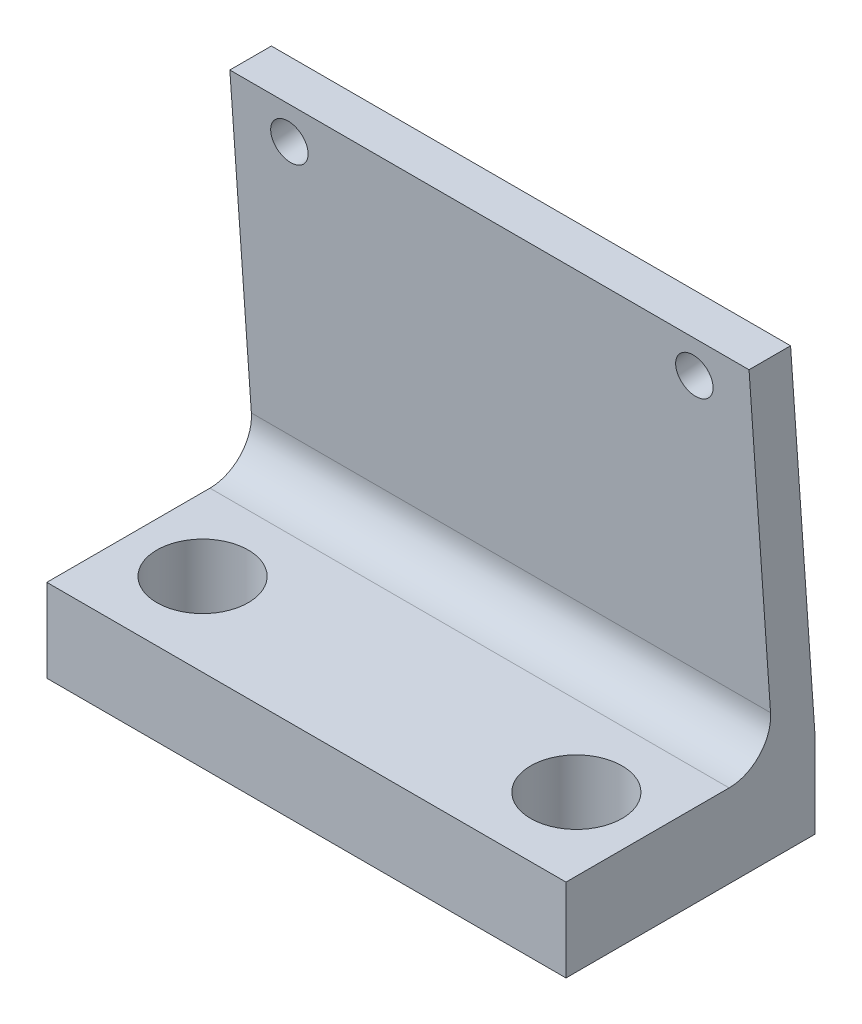
from build123d import *

# Parameters (mm, degrees)
ESQUISSE1_W             = 25
ESQUISSE1_H             = 12
ESQUISSE1_R             = 2.2
BOSS_EXTRU_1_DEPTH      = 4
ESQUISSE5_W             = 25
ESQUISSE5_H             = 2
BOSS_EXTRU_2_DEPTH      = 17
ESQUISSE6_R             = 0.9
ENL_V_MAT_EXTRU_1_DEPTH = 17
CONG_2_R                = 2


with BuildPart() as part:
    # Esquisse1 → Boss.-Extru.1 (new body)
    with BuildSketch(Plane(origin=(0, 0, 0), x_dir=(1, 0, 0), z_dir=(0, 1, 0))):
        with Locations((0, 1.258064516)):
            Rectangle(ESQUISSE1_W, ESQUISSE1_H)
        with Locations(Location((9, -0.741935484, 0), (0, 0, 270))):
            Circle(ESQUISSE1_R, mode=Mode.SUBTRACT)
        with Locations(Location((-9, -0.741935484, 0), (0, 0, 270))):
            Circle(ESQUISSE1_R, mode=Mode.SUBTRACT)
    extrude(amount=BOSS_EXTRU_1_DEPTH)

    # Esquisse5 → Boss.-Extru.2 (add, along a direction that is not the sketch's normal)
    with BuildSketch(Plane(origin=(0, 4, 0), x_dir=(1, 0, 0), z_dir=(0, 1, 0))):
        with Locations((0, 6.258064516)):
            Rectangle(ESQUISSE5_W, ESQUISSE5_H)
    extrude(amount=BOSS_EXTRU_2_DEPTH, dir=(0, 0.9975640502598248, 0.06975647374411817))

    # Esquisse6 → Enlèv. mat.-Extru.1 (cut)
    with BuildSketch(Plane(origin=(0, 0.385354434, -5.510825157), x_dir=(1, 0, 0), z_dir=(0, -0.06975647374411817, 0.9975640502598248))):
        with Locations(Location((-9.75, 18.940348686, 0), (0, 0, 270))):
            Circle(ESQUISSE6_R)
        with Locations(Location((9.75, 18.940348686, 0), (0, 0, 270))):
            Circle(ESQUISSE6_R)
    extrude(amount=-ENL_V_MAT_EXTRU_1_DEPTH, mode=Mode.SUBTRACT)

    # Congé2
    cong_2_edges = [part.edges().sort_by_distance(p)[0] for p in [
        (0, 4, -5.258064516),
    ]]
    fillet(cong_2_edges, radius=CONG_2_R)


solid = part.part
